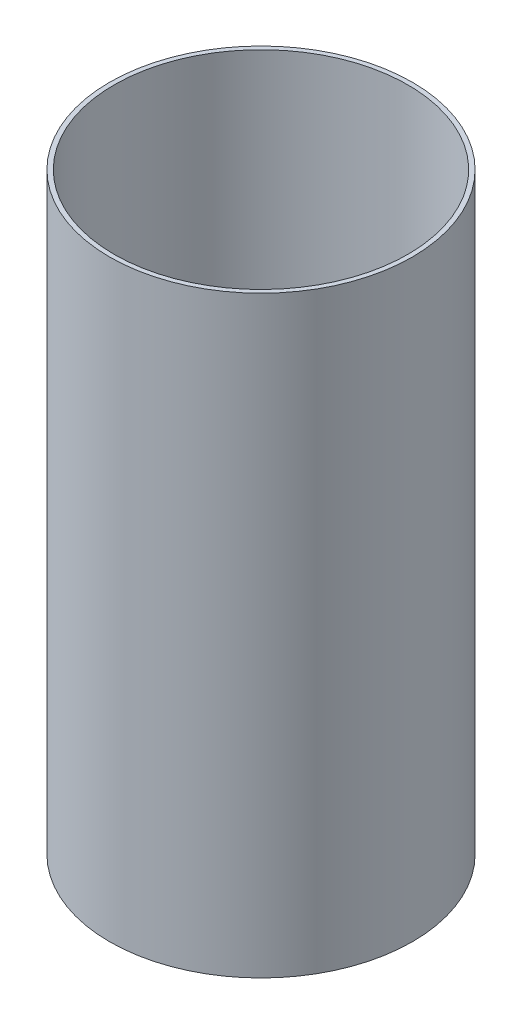
from build123d import *

# Parameters (mm, degrees)
SKETCH1_W = 200
SKETCH1_H = 1.524


with BuildPart() as part:
    # Sketch1 → Revolve1 (revolve)
    with BuildSketch(Plane(origin=(0, 0, 0), x_dir=(0, 1, 0), z_dir=(0, 0, 1)), mode=Mode.PRIVATE) as revolve1_sk:
        with Locations((1878, 50.292)):
            Rectangle(SKETCH1_W, SKETCH1_H)
    revolve(revolve1_sk.sketch.rotate(Axis((0, 1988, 0), (0, -1, 0)), 270), axis=Axis((0, 1988, 0), (0, -1, 0)))


solid = part.part
